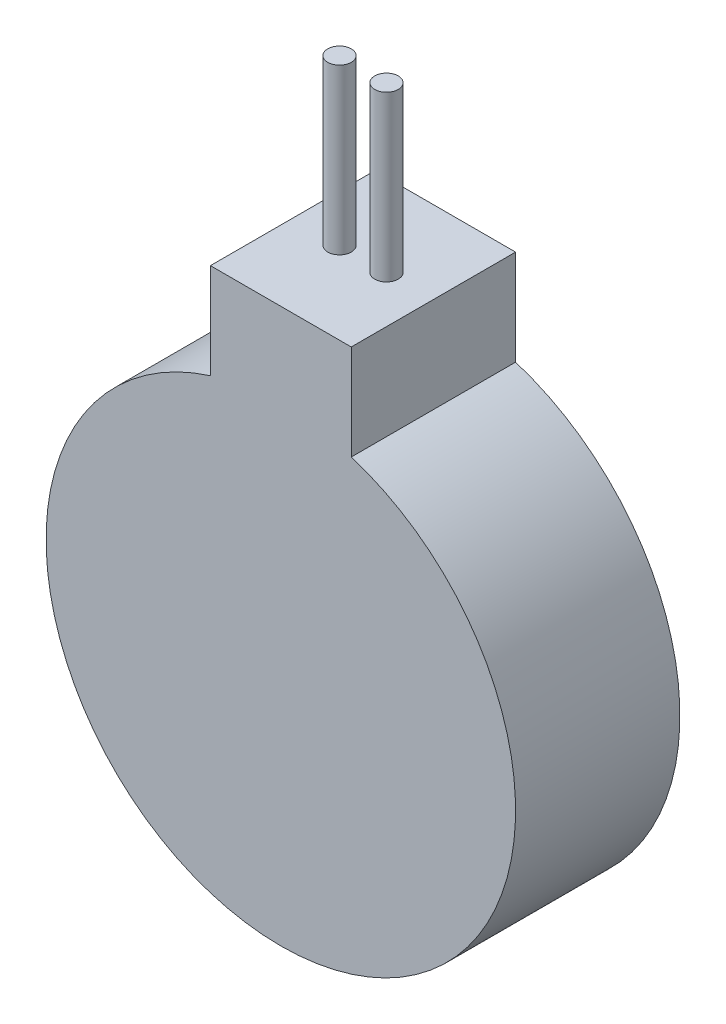
from build123d import *

# Parameters (mm, degrees)
BOSS_EXTRUDE1_DEPTH = 3.5
SKETCH2_R           = 0.25
BOSS_EXTRUDE2_DEPTH = 3.5


with BuildPart() as part:
    # Sketch1 → Boss-Extrude1 (new body)
    with BuildSketch(Plane.XY):
        with BuildLine():
            Line((-1.5, 4.769696007), (-1.5, 6.8))
            Line((-1.5, 6.8), (1.5, 6.8))
            Line((1.5, 6.8), (1.5, 4.769696007))
            ThreePointArc((1.5, 4.769696007), (0, -5), (-1.5, 4.769696007))
        make_face()
    extrude(amount=BOSS_EXTRUDE1_DEPTH)

    # Sketch2 → Boss-Extrude2 (add)
    with BuildSketch(Plane(origin=(0, 6.8, 0), x_dir=(1, 0, 0), z_dir=(0, 1, 0))):
        with Locations(Location((-0.5, -1.75, 0), (0, 0, 90))):
            Circle(SKETCH2_R)
        with Locations(Location((0.5, -1.75, 0), (0, 0, 90))):
            Circle(SKETCH2_R)
    extrude(amount=BOSS_EXTRUDE2_DEPTH)


solid = part.part
